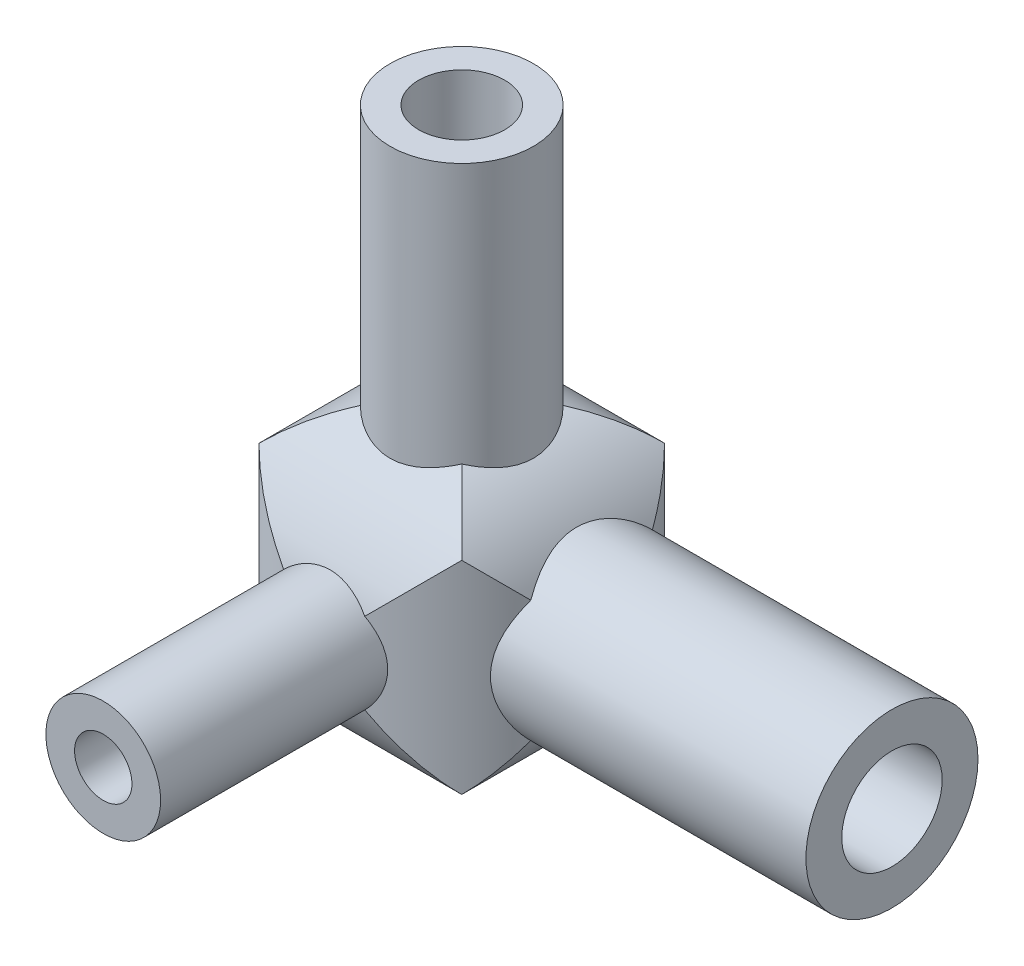
from build123d import *

# Parameters (mm, degrees)
SKETCH_1_R          = 20
EXTRUDE_1_DEPTH     = 40
SKETCH_2_W          = 40.001
SKETCH_2_H          = 40.001
SKETCH_2_R          = 20
CUT_EXTRUDE_1_DEPTH = 20
SKETCH_3_W          = 40.001
SKETCH_3_H          = 40.001
SKETCH_3_R          = 20
CUT_EXTRUDE_2_DEPTH = 20
SKETCH_16_W         = 40.001
SKETCH_16_H         = 40.001
SKETCH_16_R         = 20
CUT_EXTRUDE_5_DEPTH = 20
SWEEP_6_PROFILE_R   = 12
SWEEP_8_PROFILE_R   = 10
SWEEP_10_PROFILE_R  = 8
SWEEP_12_PROFILE_R  = 6
SWEEP_14_PROFILE_R  = 6
SWEEP_2_PROFILE_R   = 7
SWEEP_4_PROFILE_R   = 6
SWEEP_6_2_PROFILE_R = 4


with BuildPart() as part:
    # 草图1 → 凸台-拉伸1 (new body)
    with BuildSketch(Plane.XY.offset(-20)):
        Circle(SKETCH_1_R)
    extrude(amount=EXTRUDE_1_DEPTH)

    # 草图2 → 切除-拉伸1 (cut, symmetric)
    with BuildSketch(Plane(origin=(-20, 0, 0), x_dir=(0, 0, -1), z_dir=(1, 0, 0))):
        Rectangle(SKETCH_2_W, SKETCH_2_H)
        Circle(SKETCH_2_R, mode=Mode.SUBTRACT)
    extrude(amount=CUT_EXTRUDE_1_DEPTH, both=True, mode=Mode.SUBTRACT)

    # 草图3 → 切除-拉伸2 (cut, symmetric)
    with BuildSketch(Plane(origin=(0, 0, 0), x_dir=(0, 0, -1), z_dir=(1, 0, 0))):
        Rectangle(SKETCH_3_W, SKETCH_3_H)
        Circle(SKETCH_3_R, mode=Mode.SUBTRACT)
    extrude(amount=CUT_EXTRUDE_2_DEPTH, both=True, mode=Mode.SUBTRACT)

    # 草图16 → 切除-拉伸5 (cut, symmetric)
    with BuildSketch(Plane(origin=(0, 0, 0), x_dir=(1, 0, 0), z_dir=(0, 1, 0))):
        Rectangle(SKETCH_16_W, SKETCH_16_H)
        Circle(SKETCH_16_R, mode=Mode.SUBTRACT)
    extrude(amount=CUT_EXTRUDE_5_DEPTH, both=True, mode=Mode.SUBTRACT)

    # Sweep 6: sweep along a curve in space
    with BuildLine() as sweep_6_path:
        Line((0, 0, 0), (60, 0, 0))
    # Sweep 6 profile (on start of the path) → Sweep 6 (sweep)
    with BuildSketch(Plane(origin=(0, 0, 0), x_dir=(0, 0, 1), z_dir=(1, 0, 0))):
        Circle(SWEEP_6_PROFILE_R)
    sweep(path=sweep_6_path.line)

    # 扫描8: sweep along a curve in space
    with BuildLine() as sweep_8_path:
        Line((0, 0, 0), (0, 55, 0))
    # 扫描8 profile (on start of the path) → 扫描8 (sweep)
    with BuildSketch(Plane.ZX):
        Circle(SWEEP_8_PROFILE_R)
    sweep(path=sweep_8_path.line)

    # 扫描10: sweep along a curve in space
    with BuildLine() as sweep_10_path:
        Line((0, 0, 0), (0, 0, 50))
    # 扫描10 profile (on start of the path) → 扫描10 (sweep)
    with BuildSketch(Plane.XY):
        Circle(SWEEP_10_PROFILE_R)
    sweep(path=sweep_10_path.line)

    # 扫描12: sweep along a curve in space
    with BuildLine() as sweep_12_path:
        Line((0, 0, 0), (-16.666666, -16.666666, -16.666666))
    # 扫描12 profile (on start of the path) → 扫描12 (sweep)
    with BuildSketch(Plane(origin=(0, 0, 0), x_dir=(-0.7071067811865476, 0, 0.7071067811865476), z_dir=(-0.5773502691896257, -0.5773502691896257, -0.5773502691896257))):
        Circle(SWEEP_12_PROFILE_R)
    sweep(path=sweep_12_path.line)

    # 扫描14: sweep along a curve in space
    with BuildLine() as sweep_14_path:
        Line((-11.547005, -11.547005, -11.547005), (-28.867513, -28.867513, -28.867513))
    # 扫描14 profile (on start of the path) → 扫描14 (sweep)
    with BuildSketch(Plane(origin=(-11.547005, -11.547005, -11.547005), x_dir=(-0.7071067811865476, 0, 0.7071067811865476), z_dir=(-0.5773502691896257, -0.5773502691896257, -0.5773502691896257))):
        Circle(SWEEP_14_PROFILE_R)
    sweep(path=sweep_14_path.line)

    # 草图22 → 旋转1 (revolve)
    with BuildSketch(Plane(origin=(0, -28.867513, 0), x_dir=(1, 0, 0), z_dir=(0, 1, 0))):
        with BuildLine():
            Line((-22.867513, 28.867513), (-34.867513, 28.867513))
            ThreePointArc((-34.867513, 28.867513), (-28.867513, 34.867513), (-22.867513, 28.867513))
        make_face()
    revolve(axis=Axis((-34.867513, -28.867513, -28.867513), (1, 0, 0)))

    # 切除-扫描2: sweep along a curve in space
    with BuildLine() as sweep_2_path:
        Line((61, 0, 0), (-5, 0, 0))
    # 切除-扫描2 profile (on start of the path) → 切除-扫描2 (sweep, cut)
    with BuildSketch(Plane(origin=(61, 0, 0), x_dir=(0, 0, -1), z_dir=(-1, 0, 0))):
        Circle(SWEEP_2_PROFILE_R)
    sweep(path=sweep_2_path.line, mode=Mode.SUBTRACT)

    # 切除-扫描4: sweep along a curve in space
    with BuildLine() as sweep_4_path:
        Line((0, 56, 0), (0, -5, 0))
    # 切除-扫描4 profile (on start of the path) → 切除-扫描4 (sweep, cut)
    with BuildSketch(Plane(origin=(0, 56, 0), x_dir=(0, 0, -1), z_dir=(0, -1, 0))):
        Circle(SWEEP_4_PROFILE_R)
    sweep(path=sweep_4_path.line, mode=Mode.SUBTRACT)

    # Sweep 6 2: sweep along a curve in space
    with BuildLine() as sweep_6_2_path:
        Line((0, 0, 51), (0, 0, -5))
    # Sweep 6 2 profile (on start of the path) → Sweep 6 2 (sweep, cut)
    with BuildSketch(Plane(origin=(0, 0, 51), x_dir=(-1, 0, 0), z_dir=(0, 0, -1))):
        Circle(SWEEP_6_2_PROFILE_R)
    sweep(path=sweep_6_2_path.line, mode=Mode.SUBTRACT)


solid = part.part
